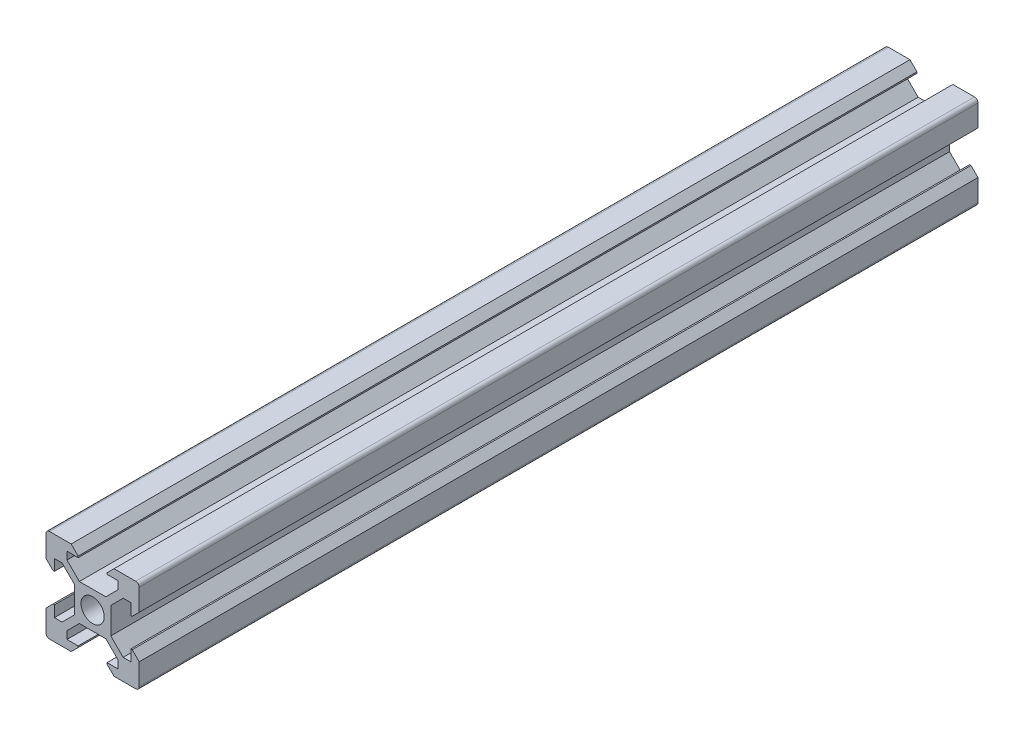
from build123d import *

# Parameters (mm, degrees)
CROQUIS1_R              = 2.5
SALIENTE_EXTRUIR1_DEPTH = 480
CUT_EXTRUDE1_DEPTH      = 25
CUT_EXTRUDE1_DEPTH_BACK = 24
SKETCH2_W               = 600
SKETCH2_H               = 26.97008712


with BuildPart() as part:
    # Croquis1 → Saliente-Extruir1 (new body)
    with BuildSketch(Plane.XY):
        with BuildLine():
            Line((-4.6, 10), (-3.1, 8.5))
            Line((-3.1, 8.5), (-3.1, 8.2))
            Line((-3.1, 8.2), (-5.5, 8.2))
            Line((-5.5, 8.2), (-5.5, 6.560660172))
            Line((-5.5, 6.560660172), (-2.84, 3.900660172))
            Line((-2.84, 3.900660172), (0, 3.900660172))
            Line((0, 3.900660172), (2.84, 3.900660172))
            Line((2.84, 3.900660172), (5.5, 6.560660172))
            Line((5.5, 6.560660172), (5.5, 8.2))
            Line((5.5, 8.2), (3.1, 8.2))
            Line((3.1, 8.2), (3.1, 8.5))
            Line((3.1, 8.5), (4.6, 10))
            Line((4.6, 10), (9.25, 10))
            ThreePointArc((9.25, 10), (9.780330086, 9.780330086), (10, 9.25))
            Line((10, 9.25), (10, 4.6))
            Line((10, 4.6), (8.5, 3.1))
            Line((8.5, 3.1), (8.2, 3.1))
            Line((8.2, 3.1), (8.2, 5.5))
            Line((8.2, 5.5), (6.560660172, 5.5))
            Line((6.560660172, 5.5), (3.900660172, 2.84))
            Line((3.900660172, 2.84), (3.900660172, 0))
            Line((3.900660172, 0), (3.900660172, -2.84))
            Line((3.900660172, -2.84), (6.560660172, -5.5))
            Line((6.560660172, -5.5), (8.2, -5.5))
            Line((8.2, -5.5), (8.2, -3.1))
            Line((8.2, -3.1), (8.5, -3.1))
            Line((8.5, -3.1), (10, -4.6))
            Line((10, -4.6), (10, -9.25))
            ThreePointArc((10, -9.25), (9.780330086, -9.780330086), (9.25, -10))
            Line((9.25, -10), (4.6, -10))
            Line((4.6, -10), (3.1, -8.5))
            Line((3.1, -8.5), (3.1, -8.2))
            Line((3.1, -8.2), (5.5, -8.2))
            Line((5.5, -8.2), (5.5, -6.560660172))
            Line((5.5, -6.560660172), (2.84, -3.900660172))
            Line((2.84, -3.900660172), (0, -3.900660172))
            Line((0, -3.900660172), (-2.84, -3.900660172))
            Line((-2.84, -3.900660172), (-5.5, -6.560660172))
            Line((-5.5, -6.560660172), (-5.5, -8.2))
            Line((-5.5, -8.2), (-3.1, -8.2))
            Line((-3.1, -8.2), (-3.1, -8.5))
            Line((-3.1, -8.5), (-4.6, -10))
            Line((-4.6, -10), (-9.25, -10))
            ThreePointArc((-9.25, -10), (-9.780330086, -9.780330086), (-10, -9.25))
            Line((-10, -9.25), (-10, -4.6))
            Line((-10, -4.6), (-8.5, -3.1))
            Line((-8.5, -3.1), (-8.2, -3.1))
            Line((-8.2, -3.1), (-8.2, -5.5))
            Line((-8.2, -5.5), (-6.560660172, -5.5))
            Line((-6.560660172, -5.5), (-3.900660172, -2.84))
            Line((-3.900660172, -2.84), (-3.900660172, 0))
            Line((-3.900660172, 0), (-3.900660172, 2.84))
            Line((-3.900660172, 2.84), (-6.560660172, 5.5))
            Line((-6.560660172, 5.5), (-8.2, 5.5))
            Line((-8.2, 5.5), (-8.2, 3.1))
            Line((-8.2, 3.1), (-8.5, 3.1))
            Line((-8.5, 3.1), (-10, 4.6))
            Line((-10, 4.6), (-10, 9.25))
            ThreePointArc((-10, 9.25), (-9.780330086, 9.780330086), (-9.25, 10))
            Line((-9.25, 10), (-4.6, 10))
        make_face()
        Circle(CROQUIS1_R, mode=Mode.SUBTRACT)
    extrude(amount=SALIENTE_EXTRUIR1_DEPTH)

    # Sketch2 → Cut-Extrude1 (cut, two sides: drawn at the far end of the back side and taken through both)
    with BuildSketch(Plane(origin=(0, 0, 0), x_dir=(0, 0, -1), z_dir=(1, 0, 0)).offset(-CUT_EXTRUDE1_DEPTH_BACK)):
        Rectangle(SKETCH2_W, SKETCH2_H)
    extrude(amount=CUT_EXTRUDE1_DEPTH + CUT_EXTRUDE1_DEPTH_BACK, mode=Mode.SUBTRACT)


solid = part.part
